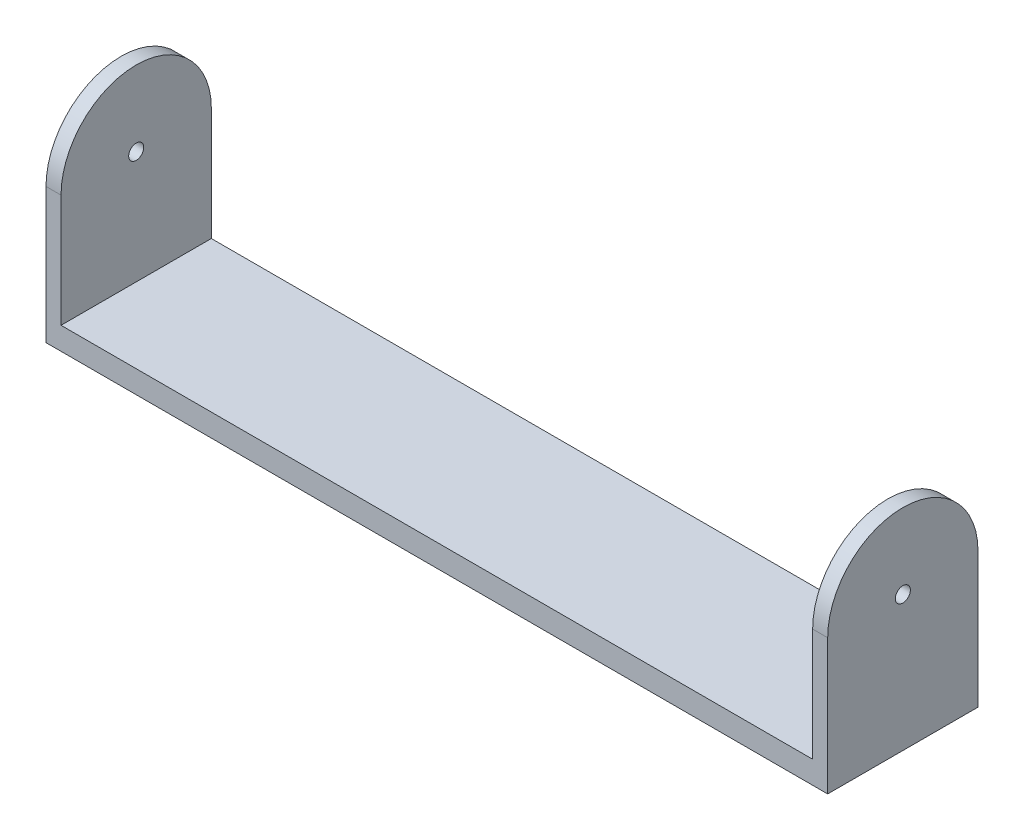
from build123d import *

# Parameters (mm, degrees)
SKETCH1_W               = 1040
SKETCH1_H               = 30
BOSS_EXTRUDE1_DEPTH     = 200
BOSS_EXTRUDE3_DEPTH     = 20
CUT_EXTRUDE1_DEPTH      = 1070.065012055
CUT_EXTRUDE1_DEPTH_BACK = 1070.065012055
SKETCH3_R               = 10


with BuildPart() as part:
    # Sketch1 → Boss-Extrude1 (new body)
    with BuildSketch(Plane.XY):
        with Locations((520, -15)):
            Rectangle(SKETCH1_W, SKETCH1_H)
    extrude(amount=BOSS_EXTRUDE1_DEPTH)

    # Sketch2 → Boss-Extrude3 (add)
    with BuildSketch(Plane(origin=(1040, 0, 0), x_dir=(0, 0, -1), z_dir=(1, 0, 0))):
        with BuildLine():
            Line((-200, 0), (-200, 150))
            ThreePointArc((-200, 150), (-100, 250), (0, 150))
            Line((0, 150), (0, 0))
            Line((0, 0), (-200, 0))
        make_face()
    boss_extrude3 = extrude(amount=-BOSS_EXTRUDE3_DEPTH)

    # Mirror2: Boss-Extrude3 across plane
    add(boss_extrude3.mirror(Plane(origin=(520, 0, 0), x_dir=(0, 0, 1), z_dir=(1, 0, 0))))

    # Sketch3 → Cut-Extrude1 (cut, two sides: drawn at the far end of the back side and taken through both)
    with BuildSketch(Plane(origin=(20, 0, 0), x_dir=(0, 0, -1), z_dir=(1, 0, 0)).offset(-CUT_EXTRUDE1_DEPTH_BACK)):
        with Locations(Location((-100, 150, 0), (0, 0, 90))):
            Circle(SKETCH3_R)
    extrude(amount=CUT_EXTRUDE1_DEPTH + CUT_EXTRUDE1_DEPTH_BACK, mode=Mode.SUBTRACT)


solid = part.part
